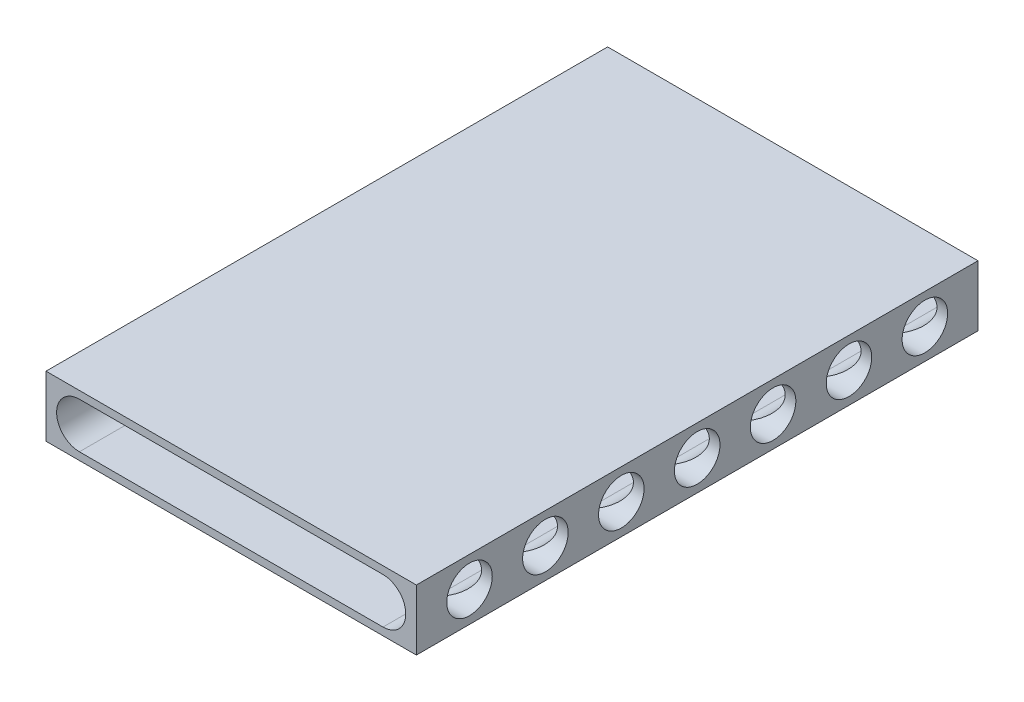
from build123d import *

# Parameters (mm, degrees)
SKETCH1_W               = 122
SKETCH1_H               = 185
BOSS_EXTRUDE1_DEPTH     = 20
CUT_EXTRUDE1_DEPTH      = 196.821347151
CUT_EXTRUDE2_REACH      = 156.403
CUT_EXTRUDE2_END_RADIUS = 7.5
SKETCH2_R               = 7.5


with BuildPart() as part:
    # Sketch1 → Boss-Extrude1 (new body)
    with BuildSketch(Plane(origin=(0, 0, 0), x_dir=(1, 0, 0), z_dir=(0, 1, 0))):
        Rectangle(SKETCH1_W, SKETCH1_H)
    extrude(amount=BOSS_EXTRUDE1_DEPTH)

    # Sketch3 → Cut-Extrude1 (cut, through all)
    with BuildSketch(Plane.XY.offset(92.5)):
        with BuildLine():
            Line((-50, 17.5), (50, 17.5))
            ThreePointArc((50, 17.5), (57.5, 10), (50, 2.5))
            Line((50, 2.5), (-50, 2.5))
            ThreePointArc((-50, 2.5), (-57.5, 10), (-50, 17.5))
        make_face()
    extrude(amount=-CUT_EXTRUDE1_DEPTH, mode=Mode.SUBTRACT)

    # Cut-Extrude2: up to this cylinder (the profile starts outside it)
    cut_extrude2_end = Plane(origin=(50, 10, 0), z_dir=(0, 0, 1)) * Cylinder(CUT_EXTRUDE2_END_RADIUS, 478.806, mode=Mode.PRIVATE)
    # Sketch2 → Cut-Extrude2 (cut, up to the surface)
    with BuildSketch(Plane(origin=(61, 0, 0), x_dir=(0, 0, -1), z_dir=(1, 0, 0)), mode=Mode.PRIVATE) as cut_extrude2_sk1:
        with Locations((-75, 10)):
            Circle(SKETCH2_R)
    cut_extrude2_tool1 = extrude(cut_extrude2_sk1.sketch, amount=-CUT_EXTRUDE2_REACH, mode=Mode.PRIVATE) - cut_extrude2_end
    add(cut_extrude2_tool1.solids().sort_by_distance((61, 10, 75))[0], mode=Mode.SUBTRACT)
    # Sketch2 → Cut-Extrude2 (cut, up to the surface)
    with BuildSketch(Plane(origin=(61, 0, 0), x_dir=(0, 0, -1), z_dir=(1, 0, 0)), mode=Mode.PRIVATE) as cut_extrude2_sk2:
        with Locations((-50, 10)):
            Circle(SKETCH2_R)
    cut_extrude2_tool2 = extrude(cut_extrude2_sk2.sketch, amount=-CUT_EXTRUDE2_REACH, mode=Mode.PRIVATE) - cut_extrude2_end
    add(cut_extrude2_tool2.solids().sort_by_distance((61, 10, 50))[0], mode=Mode.SUBTRACT)
    # Sketch2 → Cut-Extrude2 (cut, up to the surface)
    with BuildSketch(Plane(origin=(61, 0, 0), x_dir=(0, 0, -1), z_dir=(1, 0, 0)), mode=Mode.PRIVATE) as cut_extrude2_sk3:
        with Locations((-25, 10)):
            Circle(SKETCH2_R)
    cut_extrude2_tool3 = extrude(cut_extrude2_sk3.sketch, amount=-CUT_EXTRUDE2_REACH, mode=Mode.PRIVATE) - cut_extrude2_end
    add(cut_extrude2_tool3.solids().sort_by_distance((61, 10, 25))[0], mode=Mode.SUBTRACT)
    # Sketch2 → Cut-Extrude2 (cut, up to the surface)
    with BuildSketch(Plane(origin=(61, 0, 0), x_dir=(0, 0, -1), z_dir=(1, 0, 0)), mode=Mode.PRIVATE) as cut_extrude2_sk4:
        with Locations((0, 10)):
            Circle(SKETCH2_R)
    cut_extrude2_tool4 = extrude(cut_extrude2_sk4.sketch, amount=-CUT_EXTRUDE2_REACH, mode=Mode.PRIVATE) - cut_extrude2_end
    add(cut_extrude2_tool4.solids().sort_by_distance((61, 10, 0))[0], mode=Mode.SUBTRACT)
    # Sketch2 → Cut-Extrude2 (cut, up to the surface)
    with BuildSketch(Plane(origin=(61, 0, 0), x_dir=(0, 0, -1), z_dir=(1, 0, 0)), mode=Mode.PRIVATE) as cut_extrude2_sk5:
        with Locations((25, 10)):
            Circle(SKETCH2_R)
    cut_extrude2_tool5 = extrude(cut_extrude2_sk5.sketch, amount=-CUT_EXTRUDE2_REACH, mode=Mode.PRIVATE) - cut_extrude2_end
    add(cut_extrude2_tool5.solids().sort_by_distance((61, 10, -25))[0], mode=Mode.SUBTRACT)
    # Sketch2 → Cut-Extrude2 (cut, up to the surface)
    with BuildSketch(Plane(origin=(61, 0, 0), x_dir=(0, 0, -1), z_dir=(1, 0, 0)), mode=Mode.PRIVATE) as cut_extrude2_sk6:
        with Locations((50, 10)):
            Circle(SKETCH2_R)
    cut_extrude2_tool6 = extrude(cut_extrude2_sk6.sketch, amount=-CUT_EXTRUDE2_REACH, mode=Mode.PRIVATE) - cut_extrude2_end
    add(cut_extrude2_tool6.solids().sort_by_distance((61, 10, -50))[0], mode=Mode.SUBTRACT)
    # Sketch2 → Cut-Extrude2 (cut, up to the surface)
    with BuildSketch(Plane(origin=(61, 0, 0), x_dir=(0, 0, -1), z_dir=(1, 0, 0)), mode=Mode.PRIVATE) as cut_extrude2_sk7:
        with Locations((75, 10)):
            Circle(SKETCH2_R)
    cut_extrude2_tool7 = extrude(cut_extrude2_sk7.sketch, amount=-CUT_EXTRUDE2_REACH, mode=Mode.PRIVATE) - cut_extrude2_end
    add(cut_extrude2_tool7.solids().sort_by_distance((61, 10, -75))[0], mode=Mode.SUBTRACT)


solid = part.part
